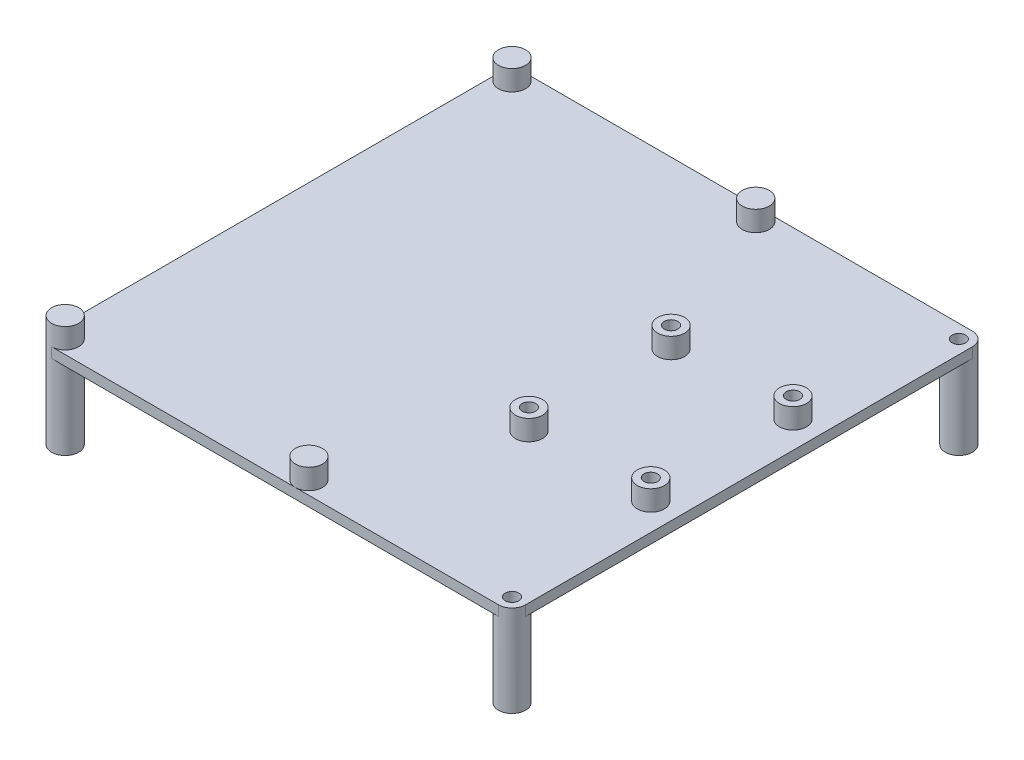
from build123d import *

# Parameters (mm, degrees)
SKETCH1_W           = 70
SKETCH1_H           = 70
SKETCH1_R           = 1
BOSS_EXTRUDE1_DEPTH = 1.5
FILLET1_R           = 2
SKETCH2_W           = 14.5
SKETCH2_H           = 16.5
CUT_EXTRUDE3_DEPTH  = 0.1
SKETCH3_R           = 3
SKETCH3_R_2         = 2
BOSS_EXTRUDE2_DEPTH = 3
BOSS_EXTRUDE3_START = 3
SKETCH4_R           = 1
SKETCH4_R_2         = 2
BOSS_EXTRUDE3_DEPTH = 3
SKETCH5_R           = 2
SKETCH5_R_2         = 1
BOSS_EXTRUDE4_DEPTH = 3
SKETCH6_R           = 2
SKETCH6_R_2         = 1
BOSS_EXTRUDE5_DEPTH = 12


with BuildPart() as part:
    # Sketch1 → Boss-Extrude1 (new body)
    with BuildSketch(Plane(origin=(0, 0, 0), x_dir=(1, 0, 0), z_dir=(0, 1, 0))):
        Rectangle(SKETCH1_W, SKETCH1_H)
        with Locations(Location((-33, 33, 0), (0, 0, 270))):
            Circle(SKETCH1_R, mode=Mode.SUBTRACT)
        with Locations(Location((-33, -33, 0), (0, 0, 90))):
            Circle(SKETCH1_R, mode=Mode.SUBTRACT)
        with Locations(Location((33, -33, 0), (0, 0, 270))):
            Circle(SKETCH1_R, mode=Mode.SUBTRACT)
        with Locations(Location((33, 33, 0), (0, 0, 90))):
            Circle(SKETCH1_R, mode=Mode.SUBTRACT)
    extrude(amount=BOSS_EXTRUDE1_DEPTH)

    # Fillet1
    fillet1_edges = [part.edges().sort_by_distance(p)[0] for p in [
        (35, 0.75, 35),
        (-35, 0.75, 35),
        (-35, 0.75, -35),
        (35, 0.75, -35),
    ]]
    fillet(fillet1_edges, radius=FILLET1_R)

    # Sketch2 → Cut-Extrude3 (cut)
    with BuildSketch(Plane.XZ):
        with Locations((0, -22)):
            Rectangle(SKETCH2_W, SKETCH2_H)
    extrude(amount=-CUT_EXTRUDE3_DEPTH, mode=Mode.SUBTRACT)

    # Sketch3 → Boss-Extrude2 (add)
    # profile 1 of 2: a face of its own
    with BuildSketch(Plane.XZ):
        with Locations(Location((7, 5, 0), (0, 0, 270))):
            Circle(SKETCH3_R)
        with Locations(Location((7, 5, 0), (0, 0, 270))):
            Circle(SKETCH3_R_2, mode=Mode.SUBTRACT)
    # profile 2 of 2: a face of its own
    with BuildSketch(Plane.XZ):
        with Locations(Location((-7, 5, 0), (0, 0, 90))):
            Circle(SKETCH3_R)
        with Locations(Location((-7, 5, 0), (0, 0, 90))):
            Circle(SKETCH3_R_2, mode=Mode.SUBTRACT)
    extrude(amount=BOSS_EXTRUDE2_DEPTH)

    # Sketch4 → Boss-Extrude3 (add)
    # profile 1 of 6: a face of its own
    with BuildSketch(Plane(origin=(0, 1.5, 0), x_dir=(1, 0, 0), z_dir=(0, 1, 0)).offset(BOSS_EXTRUDE3_START)):
        with BuildLine():
            ThreePointArc((-35, -33), (-34.414213562, -34.414213562), (-33, -35))
            ThreePointArc((-33, -35), (-31.585786438, -34.414213562), (-31, -33))
            ThreePointArc((-31, -33), (-33, -31), (-35, -33))
        make_face()
        with Locations(Location((-33, -33, 0), (0, 0, 90))):
            Circle(SKETCH4_R, mode=Mode.SUBTRACT)
    # profile 2 of 6: a face of its own
    with BuildSketch(Plane(origin=(0, 1.5, 0), x_dir=(1, 0, 0), z_dir=(0, 1, 0)).offset(BOSS_EXTRUDE3_START)):
        with Locations(Location((-33, -33, 0), (0, 0, 90))):
            Circle(SKETCH4_R)
    # profile 3 of 6: a face of its own
    with BuildSketch(Plane(origin=(0, 1.5, 0), x_dir=(1, 0, 0), z_dir=(0, 1, 0)).offset(BOSS_EXTRUDE3_START)):
        with Locations(Location((3, -33, 0), (0, 0, 270))):
            Circle(SKETCH4_R_2)
    # profile 4 of 6: a face of its own
    with BuildSketch(Plane(origin=(0, 1.5, 0), x_dir=(1, 0, 0), z_dir=(0, 1, 0)).offset(BOSS_EXTRUDE3_START)):
        with Locations(Location((3, 33, 0), (0, 0, 90))):
            Circle(SKETCH4_R_2)
    # profile 5 of 6: a face of its own
    with BuildSketch(Plane(origin=(0, 1.5, 0), x_dir=(1, 0, 0), z_dir=(0, 1, 0)).offset(BOSS_EXTRUDE3_START)):
        with BuildLine():
            ThreePointArc((-33, 35), (-34.414213562, 34.414213562), (-35, 33))
            ThreePointArc((-35, 33), (-33, 31), (-31, 33))
            ThreePointArc((-31, 33), (-31.585786438, 34.414213562), (-33, 35))
        make_face()
        with Locations(Location((-33, 33, 0), (0, 0, 270))):
            Circle(SKETCH4_R, mode=Mode.SUBTRACT)
    # profile 6 of 6: a face of its own
    with BuildSketch(Plane(origin=(0, 1.5, 0), x_dir=(1, 0, 0), z_dir=(0, 1, 0)).offset(BOSS_EXTRUDE3_START)):
        with Locations(Location((-33, 33, 0), (0, 0, 270))):
            Circle(SKETCH4_R)
    extrude(amount=-BOSS_EXTRUDE3_DEPTH)

    # Sketch5 → Boss-Extrude4 (add)
    # profile 1 of 4: a face of its own
    with BuildSketch(Plane(origin=(0, 1.5, 0), x_dir=(1, 0, 0), z_dir=(0, 1, 0))):
        with Locations(Location((13, 10.5, 0), (0, 0, 90))):
            Circle(SKETCH5_R)
        with Locations(Location((13, 10.5, 0), (0, 0, 270))):
            Circle(SKETCH5_R_2, mode=Mode.SUBTRACT)
    # profile 2 of 4: a face of its own
    with BuildSketch(Plane(origin=(0, 1.5, 0), x_dir=(1, 0, 0), z_dir=(0, 1, 0))):
        with Locations(Location((31, 10.5, 0), (0, 0, 90))):
            Circle(SKETCH5_R)
        with Locations(Location((31, 10.5, 0), (0, 0, 270))):
            Circle(SKETCH5_R_2, mode=Mode.SUBTRACT)
    # profile 3 of 4: a face of its own
    with BuildSketch(Plane(origin=(0, 1.5, 0), x_dir=(1, 0, 0), z_dir=(0, 1, 0))):
        with Locations(Location((31, -10.5, 0), (0, 0, 90))):
            Circle(SKETCH5_R)
        with Locations(Location((31, -10.5, 0), (0, 0, 270))):
            Circle(SKETCH5_R_2, mode=Mode.SUBTRACT)
    # profile 4 of 4: a face of its own
    with BuildSketch(Plane(origin=(0, 1.5, 0), x_dir=(1, 0, 0), z_dir=(0, 1, 0))):
        with Locations(Location((13, -10.5, 0), (0, 0, 90))):
            Circle(SKETCH5_R)
        with Locations(Location((13, -10.5, 0), (0, 0, 270))):
            Circle(SKETCH5_R_2, mode=Mode.SUBTRACT)
    extrude(amount=BOSS_EXTRUDE4_DEPTH)

    # Sketch6 → Boss-Extrude5 (add)
    # profile 1 of 4: a face of its own
    with BuildSketch(Plane.XZ):
        with Locations(Location((-33, 33, 0), (0, 0, 270))):
            Circle(SKETCH6_R)
        with Locations(Location((-33, 33, 0), (0, 0, 270))):
            Circle(SKETCH6_R_2, mode=Mode.SUBTRACT)
    # profile 2 of 4: a face of its own
    with BuildSketch(Plane.XZ):
        with Locations(Location((33, 33, 0), (0, 0, 270))):
            Circle(SKETCH6_R)
        with Locations(Location((33, 33, 0), (0, 0, 270))):
            Circle(SKETCH6_R_2, mode=Mode.SUBTRACT)
    # profile 3 of 4: a face of its own
    with BuildSketch(Plane.XZ):
        with Locations(Location((33, -33, 0), (0, 0, 270))):
            Circle(SKETCH6_R)
        with Locations(Location((33, -33, 0), (0, 0, 270))):
            Circle(SKETCH6_R_2, mode=Mode.SUBTRACT)
    # profile 4 of 4: a face of its own
    with BuildSketch(Plane.XZ):
        with Locations(Location((-33, -33, 0), (0, 0, 270))):
            Circle(SKETCH6_R)
        with Locations(Location((-33, -33, 0), (0, 0, 270))):
            Circle(SKETCH6_R_2, mode=Mode.SUBTRACT)
    extrude(amount=BOSS_EXTRUDE5_DEPTH)


solid = part.part
